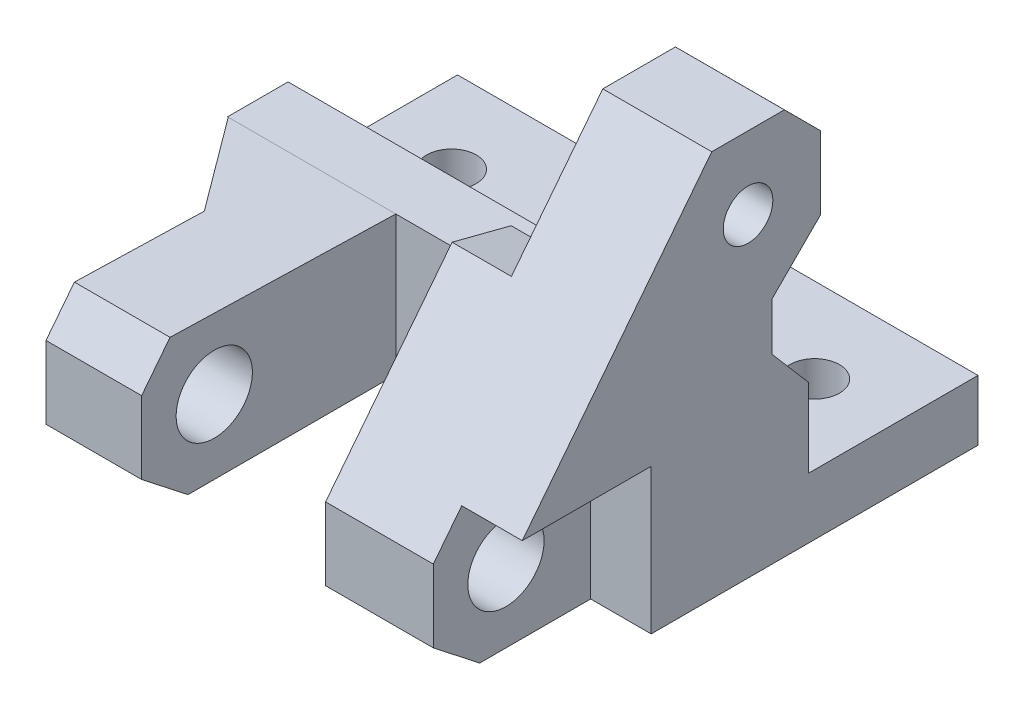
from build123d import *

# Parameters (mm, degrees)
SKETCH1_R           = 3.15
SKETCH1_R_2         = 2.05
BOSS_EXTRUDE1_DEPTH = 13.9
CUT_EXTRUDE1_DEPTH  = 5
CUT_EXTRUDE2_DEPTH  = 4.9
BOSS_EXTRUDE2_DEPTH = 29.1
BOSS_EXTRUDE3_START = 15.2
SKETCH6_R           = 3.15
BOSS_EXTRUDE3_DEPTH = 7.9
BOSS_EXTRUDE4_DEPTH = 6
CUT_EXTRUDE3_DEPTH  = 23
SKETCH9_R           = 2.05
CUT_EXTRUDE4_DEPTH  = 23


with BuildPart() as part:
    # Sketch1 → Boss-Extrude1 (new body)
    with BuildSketch(Plane(origin=(0, 0, 0), x_dir=(0, 0, -1), z_dir=(1, 0, 0))):
        Polygon((0, 0), (14, 0), (14, -5), (-22.167074323, -5), (-26, -2), (-26, 4), (-7.998085585, 27), (-1.998085585, 27), (1.001914415, 24.003735659), (1.001914415, 18.003735659), (-3.00034998, 14), (-3.00034998, 10), (0, 6.5), align=None)
        with Locations((-20, 1.104234986)):
            Circle(SKETCH1_R, mode=Mode.SUBTRACT)
        with Locations((-5, 21)):
            Circle(SKETCH1_R_2, mode=Mode.SUBTRACT)
    extrude(amount=-BOSS_EXTRUDE1_DEPTH)

    # Sketch2 → Cut-Extrude1 (cut)
    with BuildSketch(Plane(origin=(0, 0, 0), x_dir=(0, 0, -1), z_dir=(1, 0, 0))):
        Polygon((-23.651924207, 7), (-13, 7), (-13, -5), (-22.167074323, -5), (-26, -2), (-26, 4), align=None)
    extrude(amount=-CUT_EXTRUDE1_DEPTH, mode=Mode.SUBTRACT)

    # Sketch4 → Cut-Extrude2 (cut)
    with BuildSketch(Plane.ZY.offset(13.9)):
        Polygon((3.00034998, 14), (9.00034998, 14), (10.668359731, 16.093612192), (15.548359731, 17.353453452), (7.998085585, 27), (1.998085585, 27), (-1.001914415, 24.003735659), (-1.001914415, 18.003735659), align=None)
    extrude(amount=-CUT_EXTRUDE2_DEPTH, mode=Mode.SUBTRACT)

    # Sketch5 → Boss-Extrude2 (add)
    with BuildSketch(Plane.ZY.offset(13.9)):
        Polygon((0, 0), (-14, 0), (-14, -5), (5, -5), (5, 6.5), (0, 6.5), align=None)
    extrude(amount=BOSS_EXTRUDE2_DEPTH)

    # Sketch6 → Boss-Extrude3 (add)
    with BuildSketch(Plane.ZY.offset(13.9).offset(BOSS_EXTRUDE3_START)):
        Polygon((5, 6.5), (5, -5), (22.167074323, -5), (26, -2), (26, 4), (23.651924207, 7), align=None)
        with Locations(Location((20, 1.104234986, 0), (0, 0, 180))):
            Circle(SKETCH6_R, mode=Mode.SUBTRACT)
    extrude(amount=BOSS_EXTRUDE3_DEPTH)

    # Sketch7 → Boss-Extrude4 (add)
    with BuildSketch(Plane.ZY.offset(37)):
        Polygon((5, 6.5), (23.651924207, 7), (26, 4), (26, -2), (22.167074323, -5), (5, -5), align=None)
    extrude(amount=BOSS_EXTRUDE4_DEPTH)

    # Sketch8 → Cut-Extrude3 (cut)
    with BuildSketch(Plane(origin=(0, 6.361394216, -0.170529168), x_dir=(1, 0, 0), z_dir=(0, 0.9996408889737135, -0.026797259036029572))):
        Polygon((-37, -26.097852149), (-37, -13.097852149), (-43, -5.097852149), (-43, -26.097852149), align=None)
    extrude(amount=-CUT_EXTRUDE3_DEPTH, mode=Mode.SUBTRACT)

    # Sketch9 → Cut-Extrude4 (cut)
    with BuildSketch(Plane(origin=(0, 0, 0), x_dir=(1, 0, 0), z_dir=(0, 1, 0))):
        with Locations(Location((-21.5, 7, 0), (0, 0, 270))):
            Circle(SKETCH9_R)
        with Locations(Location((-6.5, 7, 0), (0, 0, 270))):
            Circle(SKETCH9_R)
        with Locations(Location((-36.5, 7, 0), (0, 0, 90))):
            Circle(SKETCH9_R)
    extrude(amount=-CUT_EXTRUDE4_DEPTH, mode=Mode.SUBTRACT)


solid = part.part
